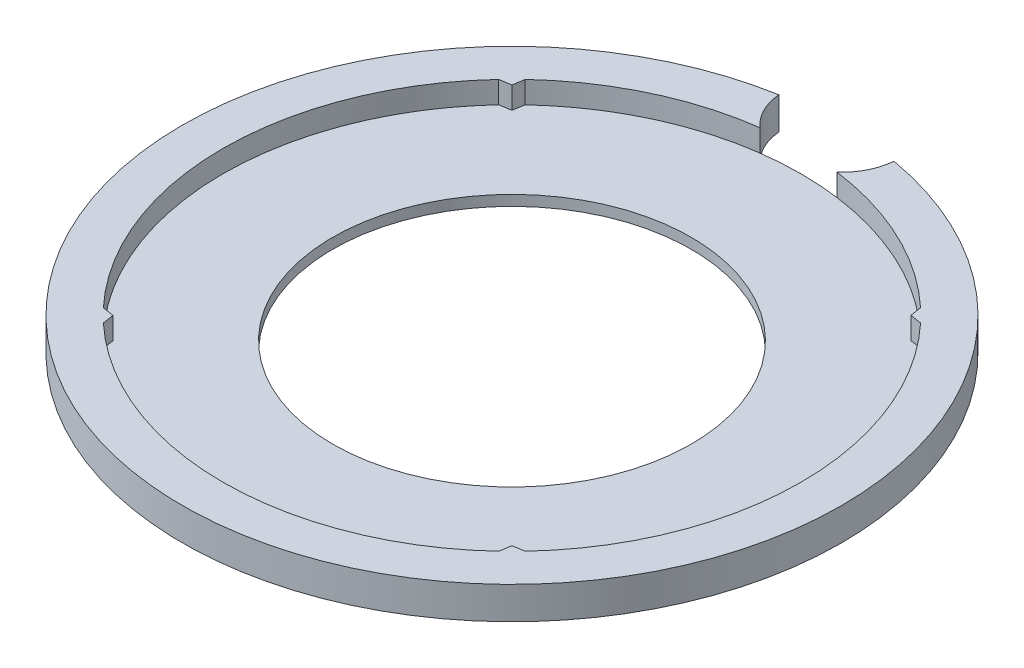
from build123d import *

# Parameters (mm, degrees)
SKETCH1_R               = 25
SKETCH1_R_2             = 15.5
BOSS_EXTRUDE1_DEPTH     = 0.9
SKETCH2_R               = 28.5
SKETCH2_R_2             = 25
BOSS_EXTRUDE2_DEPTH     = 2.8
CUT_EXTRUDE1_DEPTH      = 41.402227661
CUT_EXTRUDE1_DEPTH_BACK = 41.402227661
SKETCH3_R               = 5
BOSS_EXTRUDE3_START     = -2.8
BOSS_EXTRUDE3_DEPTH     = 2.8


with BuildPart() as part:
    # Sketch1 → Boss-Extrude1 (new body)
    with BuildSketch(Plane(origin=(0, 0, 0), x_dir=(1, 0, 0), z_dir=(0, 1, 0))):
        with Locations(Location((0, 0, 0), (0, 0, 270))):
            Circle(SKETCH1_R)
        with Locations(Location((0, 0, 0), (0, 0, 270))):
            Circle(SKETCH1_R_2, mode=Mode.SUBTRACT)
    extrude(amount=BOSS_EXTRUDE1_DEPTH)


with BuildPart() as body_2:
    # Sketch2 → Boss-Extrude2 (new body)
    with BuildSketch(Plane.XZ):
        with Locations(Location((0, 0, 0), (0, 0, 270))):
            Circle(SKETCH2_R)
        with Locations(Location((0, 0, 0), (0, 0, 270))):
            Circle(SKETCH2_R_2, mode=Mode.SUBTRACT)
    extrude(amount=-BOSS_EXTRUDE2_DEPTH)

    # Sketch3 → Cut-Extrude1 (cut, two sides: drawn at the far end of the back side and taken through both)
    with BuildSketch(Plane(origin=(0, 2.8, 0), x_dir=(1, 0, 0), z_dir=(0, 1, 0)).offset(-CUT_EXTRUDE1_DEPTH_BACK)):
        with Locations((0, 28.5)):
            Circle(SKETCH3_R)
    extrude(amount=CUT_EXTRUDE1_DEPTH + CUT_EXTRUDE1_DEPTH_BACK, mode=Mode.SUBTRACT)

    # Sketch4 → Boss-Extrude3 (add)
    with BuildSketch(Plane(origin=(0, 2.8, 0), x_dir=(1, 0, 0), z_dir=(0, 1, 0)).offset(BOSS_EXTRUDE3_START)):
        with BuildLine():
            Line((17.253405461, 17.253405461), (18.240919233, 17.095872764))
            ThreePointArc((18.240919233, 17.095872764), (17.67766953, 17.67766953), (17.095872764, 18.240919233))
            Line((17.095872764, 18.240919233), (17.253405461, 17.253405461))
        make_face()
        with BuildLine():
            ThreePointArc((17.095872764, -18.240919233), (17.67766953, -17.67766953), (18.240919233, -17.095872764))
            Line((18.240919233, -17.095872764), (17.253405461, -17.253405461))
            Line((17.253405461, -17.253405461), (17.095872764, -18.240919233))
        make_face()
        with BuildLine():
            ThreePointArc((-18.240919233, -17.095872764), (-17.67766953, -17.67766953), (-17.095872764, -18.240919233))
            Line((-17.095872764, -18.240919233), (-17.253405461, -17.253405461))
            Line((-17.253405461, -17.253405461), (-18.240919233, -17.095872764))
        make_face()
        with BuildLine():
            Line((-17.253405461, 17.253405461), (-18.240919233, 17.095872764))
            ThreePointArc((-18.240919233, 17.095872764), (-17.67766953, 17.67766953), (-17.095872764, 18.240919233))
            Line((-17.095872764, 18.240919233), (-17.253405461, 17.253405461))
        make_face()
    extrude(amount=BOSS_EXTRUDE3_DEPTH)


solid = Compound([part.part, body_2.part])
